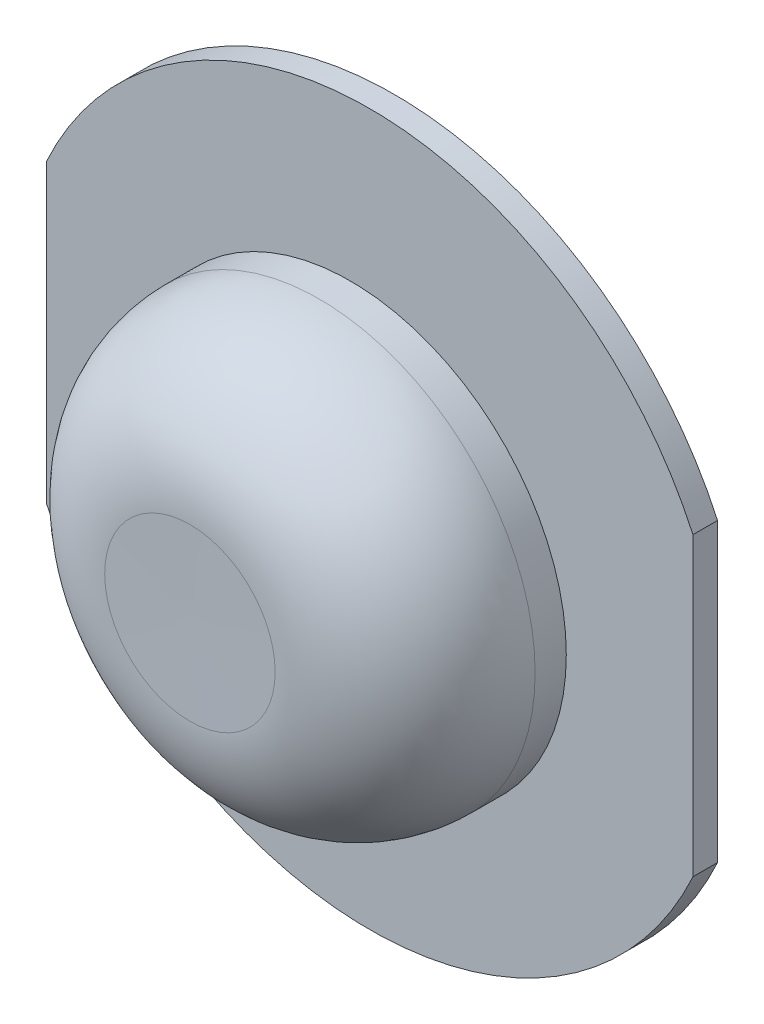
from build123d import *

# Parameters (mm, degrees)
BOSS_EXTRUDE1_DEPTH = 3.8
SKETCH4_W           = 43.3
SKETCH4_H           = 43.3
CUT_EXTRUDE1_DEPTH  = 3


with BuildPart() as part:
    # Sketch1 → Boss-Extrude1 (new body)
    with BuildSketch(Plane.XY):
        with BuildLine():
            Line((50, 22.912878475), (50, -22.912878475))
            ThreePointArc((50, -22.912878475), (0, -55), (-50, -22.912878475))
            Line((-50, -22.912878475), (-50, 22.912878475))
            ThreePointArc((-50, 22.912878475), (0, 55), (50, 22.912878475))
        make_face()
    extrude(amount=BOSS_EXTRUDE1_DEPTH)

    # Sketch4 → Cut-Extrude1 (cut)
    with BuildSketch(Plane(origin=(0, 0, 0), x_dir=(-1, 0, 0), z_dir=(0, 0, -1))):
        Rectangle(SKETCH4_W, SKETCH4_H)
    extrude(amount=-CUT_EXTRUDE1_DEPTH, mode=Mode.SUBTRACT)


with BuildPart() as body_2:
    # Sketch3 → Revolve1 (revolve)
    with BuildSketch(Plane(origin=(0, 0, 0), x_dir=(1, 0, 0), z_dir=(0, 1, 0)), mode=Mode.PRIVATE) as revolve1_sk:
        with BuildLine():
            Line((0, -6.78852246), (0, -31.46852246))
            Line((0, -31.46852246), (13.182201991, -31.608787716))
            ThreePointArc((13.182201991, -31.608787716), (27.46169897, -25.827091838), (33.395, -11.609919823))
            Line((33.395, -11.609919823), (33.395, -6.78852246))
            Line((33.395, -6.78852246), (0, -6.78852246))
        make_face()
    revolve(revolve1_sk.sketch.rotate(Axis((0, 0, 6.78852246), (0, 0, 1)), 180), axis=Axis((0, 0, 6.78852246), (0, 0, 1)))


solid = Compound([part.part, body_2.part])
